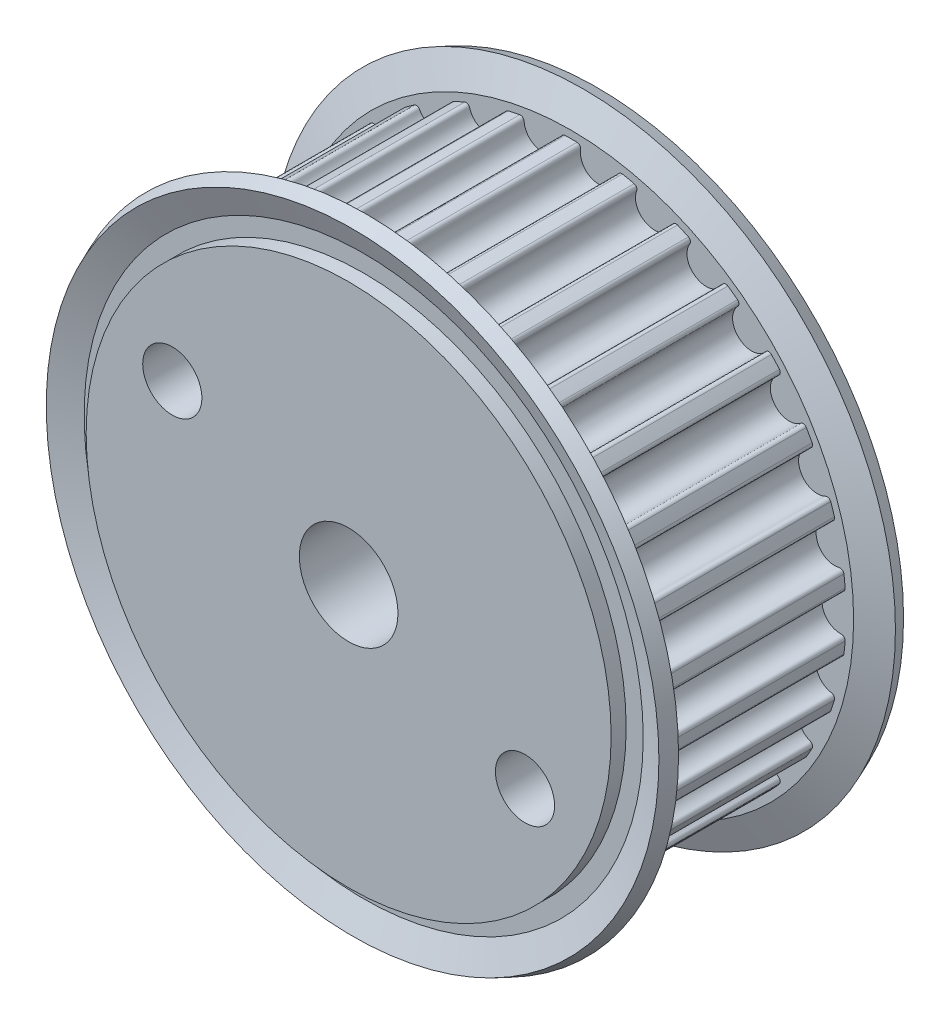
from build123d import *

# Parameters (mm, degrees)
TOOTHEXTRUDECUTGEARBELT01_DEPTH = 4.876799927
PATTERNGEARBELT01_COUNT         = 30
BOREREVOLVESKETCH_W             = 12.801599808
BOREREVOLVESKETCH_H             = 2.5
SKETCH_1_R                      = 1.500000001
CUT_EXTRUDE_1_DEPTH             = 17


with BuildPart() as part:
    # SketchRevolveGearBelt01 → GearBelt01 (revolve)
    with BuildSketch(Plane(origin=(0, 0, 0), x_dir=(0, 0, -1), z_dir=(1, 0, 0))):
        Polygon((6.400799904, 0), (6.400799904, 13.306916417), (5.638799915, 13.306916417), (5.638799915, 14.17134518), (6.201536555, 15.529911608), (5.497540362, 15.821516379), (4.876799927, 14.322916402), (4.876799927, 13.941916408), (-4.876799927, 13.941916408), (-4.876799927, 14.322916402), (-5.497540362, 15.821516379), (-6.201536555, 15.529911608), (-5.638799915, 14.17134518), (-5.638799915, 13.306916417), (-6.400799904, 13.306916417), (-6.400799904, 0), align=None)
    revolve(axis=Axis((0, 0, 0), (0, 0, -1)))

    # SketchToothGearBelt01 → ToothExtrudeCutGearBelt01 (cut, symmetric)
    with BuildSketch(Plane.XY):
        with BuildLine():
            ThreePointArc((13.893477895, 1.162049767), (13.941990091, 0), (13.893477895, -1.162049767))
            add(Edge.make_bspline(
                [(13.893477895, -1.162049767), (13.894355497, -1.151569871), (13.894367328, -1.13574137), (13.891783851, -1.114849561), (13.88856033, -1.099393952), (13.884072736, -1.084256956), (13.878351699, -1.069541767), (13.871436211, -1.055348702), (13.863373419, -1.041774518), (13.854218288, -1.028911755), (13.844033233, -1.016848102), (13.832887687, -1.005665799), (13.820857633, -0.995441086), (13.808025082, -0.986243636), (13.794477517, -0.97813627), (13.780307299, -0.971173811), (13.765611019, -0.965405397), (13.750488906, -0.960864109), (13.735043897, -0.957604207), (13.719381867, -0.955560951), (13.690295039, -0.954660893), (13.642257342, -0.955570539), (13.575220239, -0.952960995), (13.502997829, -0.944194093), (13.431675895, -0.929863568), (13.361697972, -0.909971895), (13.293492773, -0.884664268), (13.227479874, -0.85409009), (13.164064907, -0.818438922), (13.10363766, -0.777929443), (13.046569525, -0.732810753), (12.993211261, -0.683360129), (12.943890814, -0.629881514), (12.898911329, -0.572703598), (12.858549229, -0.512177812), (12.823052703, -0.448676153), (12.792639493, -0.382588943), (12.767498123, -0.314322274), (12.747777154, -0.244296081), (12.733620052, -0.172939446), (12.725030771, -0.100695851), (12.723087585, -0.04755736), (12.723178891, -0.014000083), (12.723166194, 0), (12.723178891, 0.014000083), (12.723087585, 0.04755736), (12.725030771, 0.100695851), (12.733620052, 0.172939446), (12.747777154, 0.244296081), (12.767498123, 0.314322274), (12.792639493, 0.382588943), (12.823052703, 0.448676153), (12.858549229, 0.512177812), (12.898911329, 0.572703598), (12.943890814, 0.629881514), (12.993211261, 0.683360129), (13.046569525, 0.732810753), (13.10363766, 0.777929443), (13.164064907, 0.818438922), (13.227479874, 0.85409009), (13.293492773, 0.884664268), (13.361697972, 0.909971895), (13.431675895, 0.929863568), (13.502997829, 0.944194093), (13.575220239, 0.952960995), (13.642257342, 0.955570539), (13.690295039, 0.954660893), (13.719381867, 0.955560951), (13.735043897, 0.957604207), (13.750488906, 0.960864109), (13.765611019, 0.965405397), (13.780307299, 0.971173811), (13.794477517, 0.97813627), (13.808025082, 0.986243636), (13.820857633, 0.995441086), (13.832887687, 1.005665799), (13.844033233, 1.016848102), (13.854218288, 1.028911755), (13.863373419, 1.041774518), (13.871436211, 1.055348702), (13.878351699, 1.069541767), (13.884072736, 1.084256956), (13.88856033, 1.099393952), (13.891783851, 1.114849561), (13.894367328, 1.13574137), (13.894355497, 1.151569871), (13.893477895, 1.162049767)],
                knots=[0, 0, 0, 0, 0.008512506, 0.012768759, 0.017025012, 0.021281265, 0.025537518, 0.029793771, 0.034050023, 0.038306276, 0.042562529, 0.046818782, 0.051075035, 0.055331288, 0.059587541, 0.063843794, 0.068100047, 0.0723563, 0.076612553, 0.080868806, 0.085125059, 0.100157118, 0.119771414, 0.139385711, 0.159000007, 0.178614304, 0.1982286, 0.217842897, 0.237457193, 0.257071489, 0.276685786, 0.296300082, 0.315914379, 0.335528675, 0.355142972, 0.374757268, 0.394371565, 0.413985861, 0.433600158, 0.453214454, 0.472828751, 0.492443047, 0.496221523, 0.5, 0.503778477, 0.507556953, 0.527171249, 0.546785546, 0.566399842, 0.586014139, 0.605628435, 0.625242732, 0.644857028, 0.664471325, 0.684085621, 0.703699918, 0.723314214, 0.742928511, 0.762542807, 0.782157103, 0.8017714, 0.821385696, 0.840999993, 0.860614289, 0.880228586, 0.899842882, 0.914874941, 0.919131194, 0.923387447, 0.9276437, 0.931899953, 0.936156206, 0.940412459, 0.944668712, 0.948924965, 0.953181218, 0.957437471, 0.961693724, 0.965949977, 0.970206229, 0.974462482, 0.978718735, 0.982974988, 0.987231241, 0.991487494, 1, 1, 1, 1], degree=3))
        make_face()
    toothextrudecutgearbelt01 = extrude(amount=TOOTHEXTRUDECUTGEARBELT01_DEPTH, both=True, mode=Mode.SUBTRACT)

    # PatternGearBelt01: ToothExtrudeCutGearBelt01 ×30 about axis
    patterngearbelt01_axis = Axis((0, 0, 55), (0, 0, -1))
    for i in range(1, PATTERNGEARBELT01_COUNT):
        add(toothextrudecutgearbelt01.rotate(patterngearbelt01_axis, i * 360 / PATTERNGEARBELT01_COUNT), mode=Mode.SUBTRACT)

    # BoreRevolveSketch → BoreRevolveCut (revolve, cut)
    with BuildSketch(Plane(origin=(0, 0, 0), x_dir=(0, 0, -1), z_dir=(1, 0, 0))):
        with Locations((0, 1.25)):
            Rectangle(BOREREVOLVESKETCH_W, BOREREVOLVESKETCH_H)
    revolve(axis=Axis((0, 0, 0), (0, 0, -1)), mode=Mode.SUBTRACT)

    # 草图1 → 切除-拉伸1 (cut)
    with BuildSketch(Plane(origin=(0, 0, -6.400799904), x_dir=(-1, 0, 0), z_dir=(0, 0, -1))):
        with Locations((-8.94096812, -4.478737443)):
            Circle(SKETCH_1_R)
        with Locations((8.94096812, 4.478737443)):
            Circle(SKETCH_1_R)
    extrude(amount=-CUT_EXTRUDE_1_DEPTH, mode=Mode.SUBTRACT)


solid = part.part
